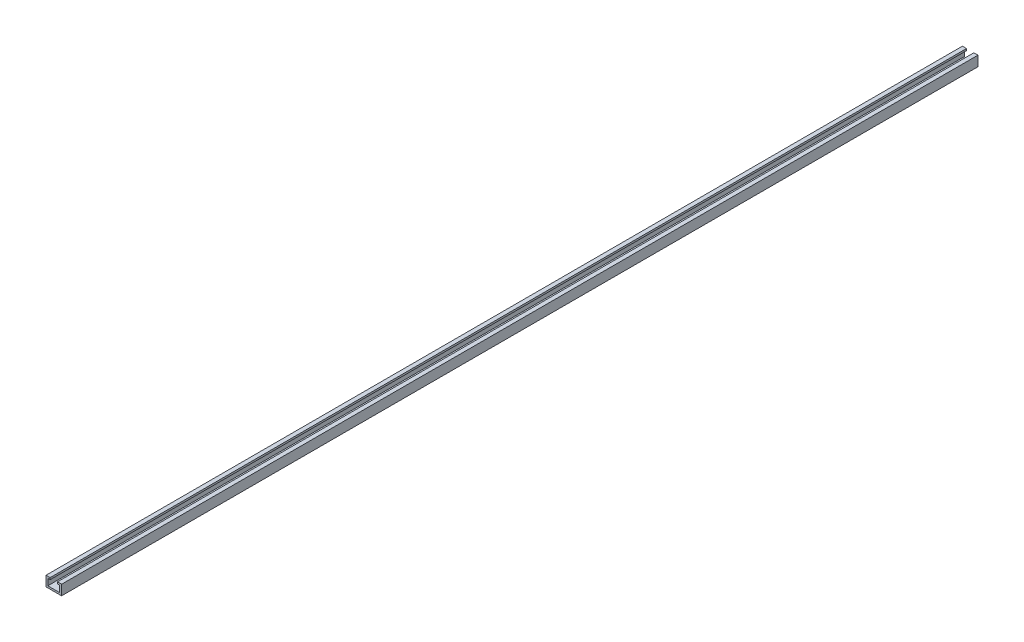
from build123d import *

# Parameters (mm, degrees)
AUFSATZ_LINEAR_AUSTRAGEN1_DEPTH = 1000


with BuildPart() as part:
    # Skizze1 → Aufsatz-Linear austragen1 (new body)
    with BuildSketch(Plane.XY):
        Polygon((-8.5, 0), (8.5, 0), (8.5, 11), (4, 11), (4, 9), (6.5, 9), (6.5, 2), (-6.5, 2), (-6.5, 9), (-4, 9), (-4, 11), (-8.5, 11), align=None)
    extrude(amount=AUFSATZ_LINEAR_AUSTRAGEN1_DEPTH)


solid = part.part
